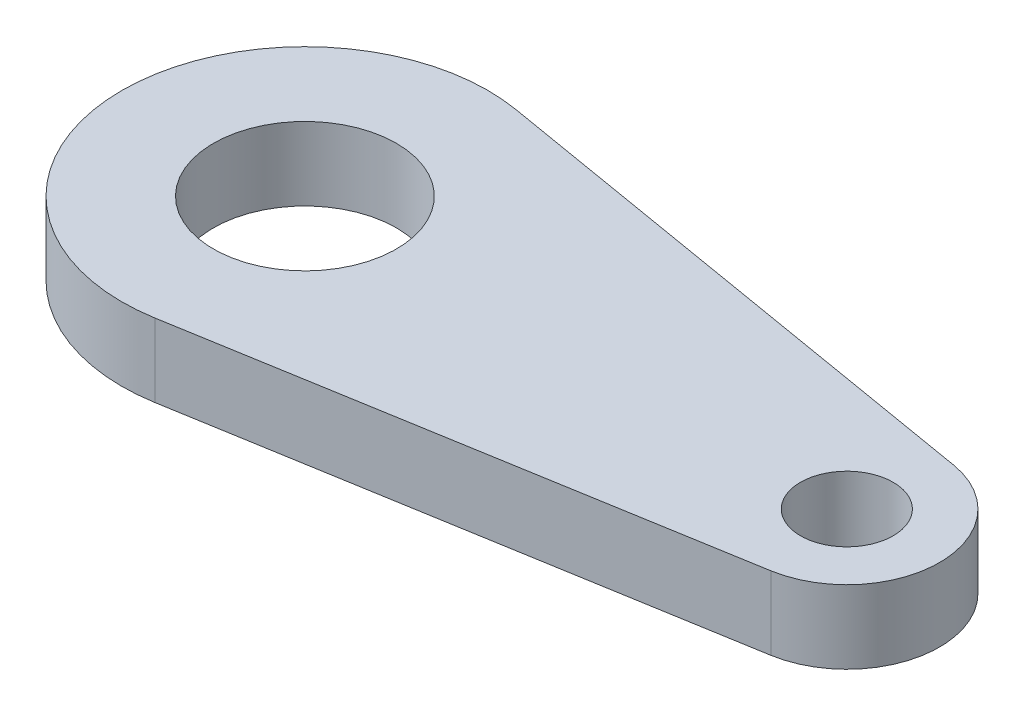
from build123d import *

# Parameters (mm, degrees)
SKETCH1_R           = 9.525
SKETCH1_R_2         = 4.826
BOSS_EXTRUDE1_DEPTH = 7.62


with BuildPart() as part:
    # Sketch1 → Boss-Extrude1 (new body)
    with BuildSketch(Plane(origin=(0, 0, 0), x_dir=(1, 0, 0), z_dir=(0, 1, 0))):
        with BuildLine():
            Line((-53.213, 18.783553311), (1.608666667, 9.517000344))
            ThreePointArc((1.608666667, 9.517000344), (9.652, 0), (1.608666667, -9.517000344))
            Line((1.608666667, -9.517000344), (-53.213, -18.783553311))
            ThreePointArc((-53.213, -18.783553311), (-75.438, 0), (-53.213, 18.783553311))
        make_face()
        with Locations(Location((-56.388, 0, 0), (0, 0, 90))):
            Circle(SKETCH1_R, mode=Mode.SUBTRACT)
        with Locations(Location((0, 0, 0), (0, 0, 90))):
            Circle(SKETCH1_R_2, mode=Mode.SUBTRACT)
    extrude(amount=BOSS_EXTRUDE1_DEPTH)


solid = part.part
